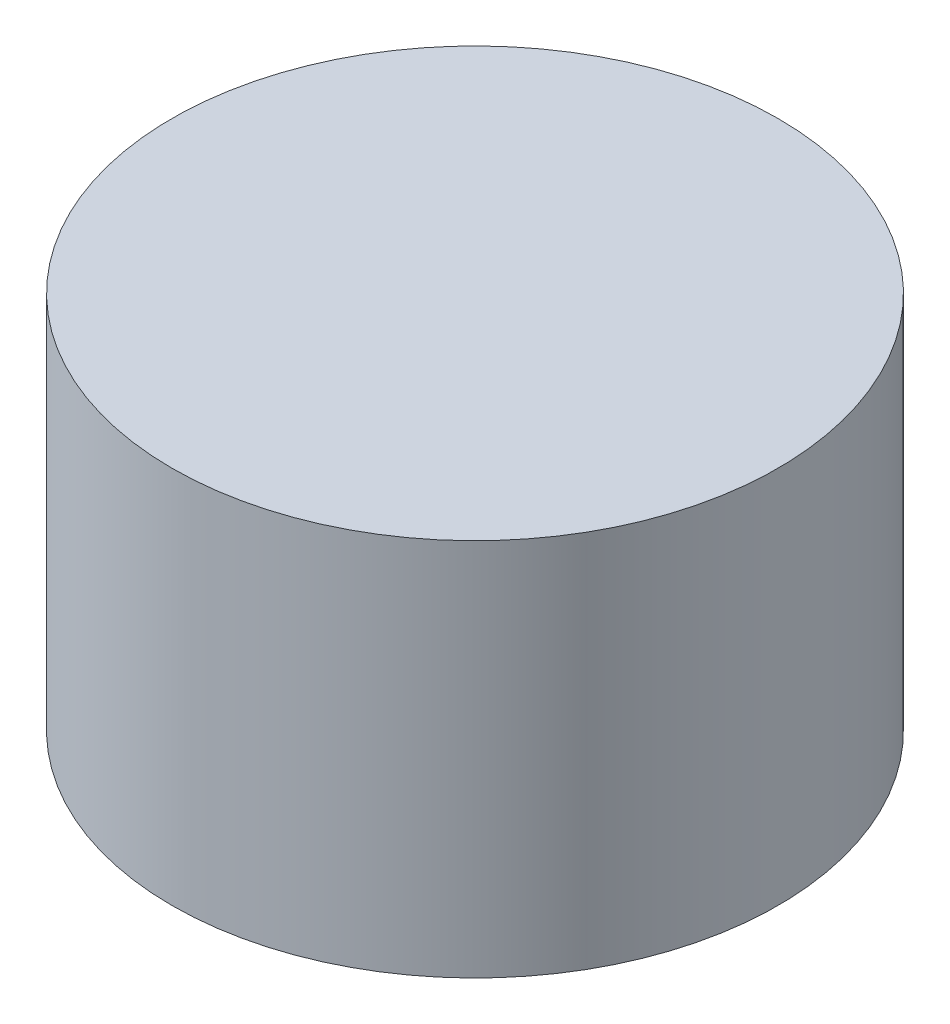
from build123d import *

# Parameters (mm, degrees)
SKETCH2_R           = 16
BOSS_EXTRUDE1_DEPTH = 20
CUT_EXTRUDE1_START  = -2
SKETCH3_R           = 15
CUT_EXTRUDE1_DEPTH  = 29.199337741
SKETCH4_R           = 3
BOSS_EXTRUDE2_DEPTH = 1


with BuildPart() as part:
    # Sketch2 → Boss-Extrude1 (new body)
    with BuildSketch(Plane(origin=(0, 0, 0), x_dir=(1, 0, 0), z_dir=(0, 1, 0))):
        with Locations(Location((0, 0, 0), (0, 0, 270))):
            Circle(SKETCH2_R)
    extrude(amount=BOSS_EXTRUDE1_DEPTH)

    # Sketch3 → Cut-Extrude1 (cut, through all)
    with BuildSketch(Plane(origin=(0, 20, 0), x_dir=(1, 0, 0), z_dir=(0, 1, 0)).offset(CUT_EXTRUDE1_START)):
        with Locations(Location((0, 0, 0), (0, 0, 270))):
            Circle(SKETCH3_R)
    extrude(amount=-CUT_EXTRUDE1_DEPTH, mode=Mode.SUBTRACT)

    # Sketch4 → Boss-Extrude2 (add)
    with BuildSketch(Plane(origin=(0, 18, 0), x_dir=(-1, 0, 0), z_dir=(0, -1, 0))):
        with Locations(Location((0, 0, 0), (0, 0, 270))):
            Circle(SKETCH4_R)
    extrude(amount=BOSS_EXTRUDE2_DEPTH)


solid = part.part
